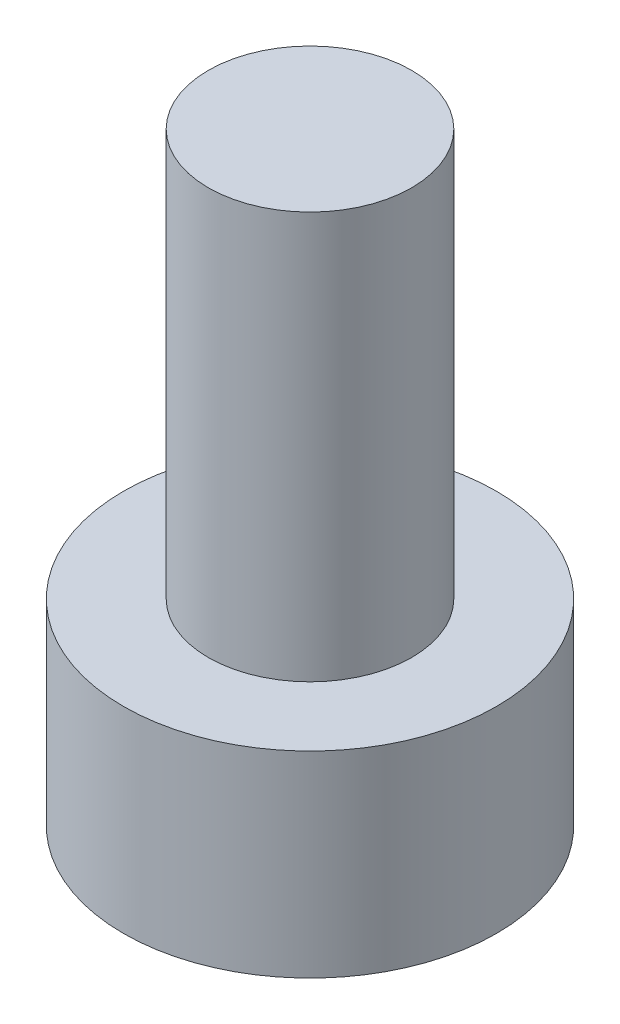
from build123d import *

# Parameters (mm, degrees)
SKETCH_1_R          = 1.5
EXTRUDE_1_DEPTH     = 6
SKETCH_2_R          = 2.75
EXTRUDE_2_DEPTH     = 2.9
CUT_EXTRUDE_1_DEPTH = 1.5


with BuildPart() as part:
    # 草图1 → 凸台-拉伸1 (new body)
    with BuildSketch(Plane(origin=(0, 0, 0), x_dir=(1, 0, 0), z_dir=(0, 1, 0))):
        with Locations(Location((0, 0, 0), (0, 0, 270))):
            Circle(SKETCH_1_R)
    extrude(amount=EXTRUDE_1_DEPTH)

    # 草图2 → 凸台-拉伸2 (add)
    with BuildSketch(Plane.XZ):
        with Locations(Location((0, 0, 0), (0, 0, 270))):
            Circle(SKETCH_2_R)
    extrude(amount=EXTRUDE_2_DEPTH)

    # 草图3 → 切除-拉伸1 (cut)
    with BuildSketch(Plane.XZ.offset(2.9)):
        Polygon((1.25, 0.721687836), (0, 1.443375673), (-1.25, 0.721687836), (-1.25, -0.721687836), (0, -1.443375673), (1.25, -0.721687836), align=None)
    extrude(amount=-CUT_EXTRUDE_1_DEPTH, mode=Mode.SUBTRACT)


solid = part.part
